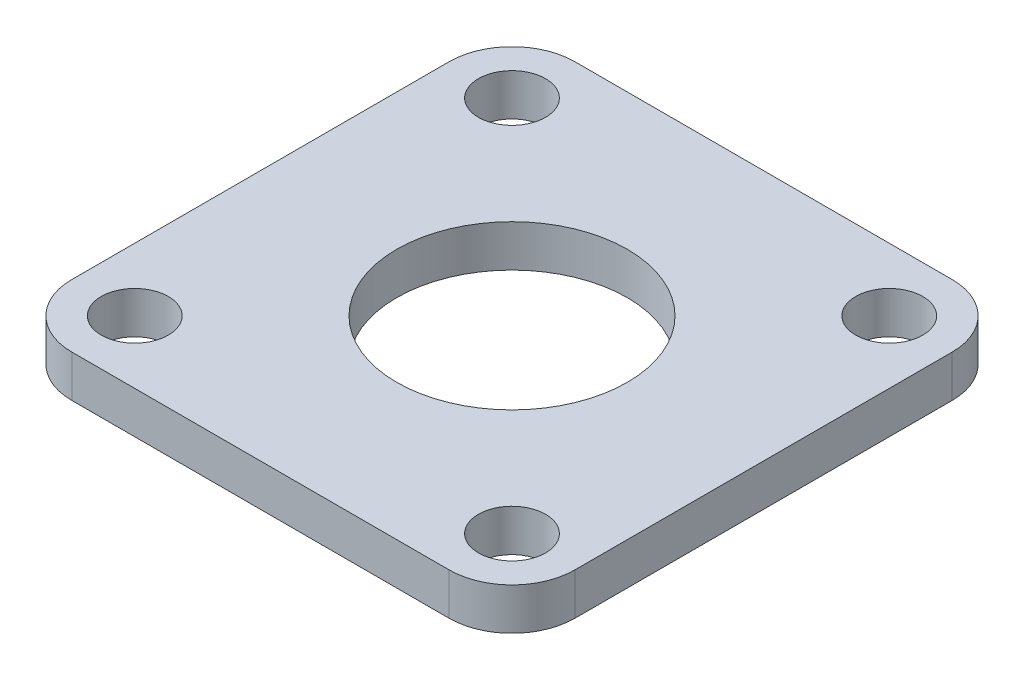
from build123d import *

# Parameters (mm, degrees)
SKETCH_1_W          = 24
SKETCH_1_H          = 24
EXTRUDE_1_DEPTH     = 2
FILLET_1_R          = 3
SKETCH_2_R          = 1.6
CUT_EXTRUDE_1_DEPTH = 2
SKETCH_3_R          = 5.5
CUT_EXTRUDE_2_DEPTH = 2


with BuildPart() as part:
    # 草图1 → 凸台-拉伸1 (new body)
    with BuildSketch(Plane(origin=(0, 0, 0), x_dir=(1, 0, 0), z_dir=(0, 1, 0))):
        Rectangle(SKETCH_1_W, SKETCH_1_H)
    extrude(amount=EXTRUDE_1_DEPTH)

    # 圆角1
    fillet_1_edges = [part.edges().sort_by_distance(p)[0] for p in [
        (12, 1, 12),
        (-12, 1, 12),
        (-12, 1, -12),
        (12, 1, -12),
    ]]
    fillet(fillet_1_edges, radius=FILLET_1_R)

    # 草图2 → 切除-拉伸1 (cut)
    with BuildSketch(Plane(origin=(0, 2, 0), x_dir=(1, 0, 0), z_dir=(0, 1, 0))):
        with Locations(Location((-9, 9, 0), (0, 0, 270))):
            Circle(SKETCH_2_R)
        with Locations(Location((9, 9, 0), (0, 0, 270))):
            Circle(SKETCH_2_R)
        with Locations(Location((9, -9, 0), (0, 0, 270))):
            Circle(SKETCH_2_R)
        with Locations(Location((-9, -9, 0), (0, 0, 270))):
            Circle(SKETCH_2_R)
    extrude(amount=-CUT_EXTRUDE_1_DEPTH, mode=Mode.SUBTRACT)

    # 草图3 → 切除-拉伸2 (cut)
    with BuildSketch(Plane(origin=(0, 2, 0), x_dir=(1, 0, 0), z_dir=(0, 1, 0))):
        with Locations(Location((0, 0, 0), (0, 0, 270))):
            Circle(SKETCH_3_R)
    extrude(amount=-CUT_EXTRUDE_2_DEPTH, mode=Mode.SUBTRACT)


solid = part.part
